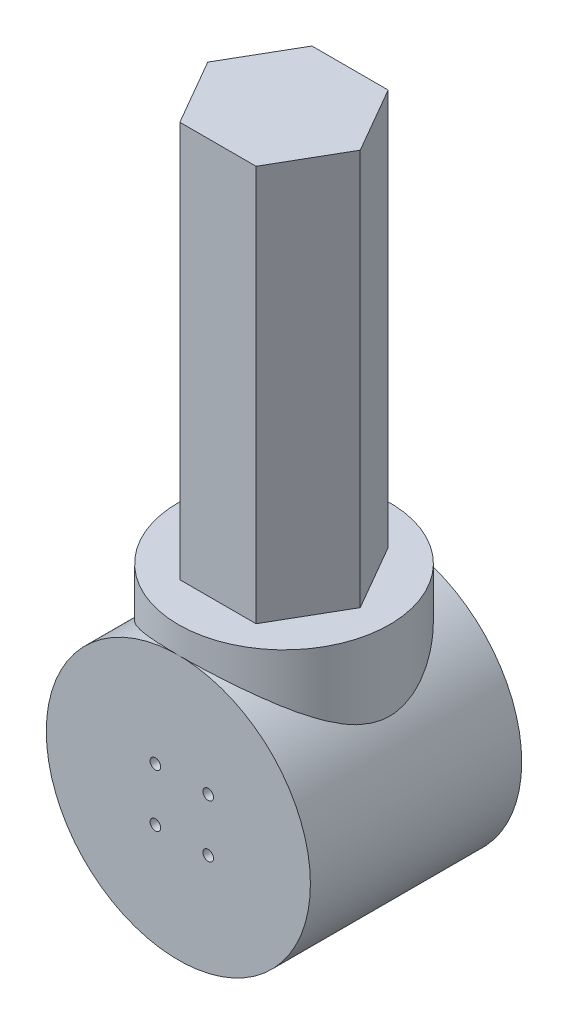
from build123d import *

# Parameters (mm, degrees)
SKETCH1_R           = 25
BOSS_EXTRUDE1_DEPTH = 40
SKETCH2_R           = 20
BOSS_EXTRUDE2_DEPTH = 25
BOSS_EXTRUDE3_DEPTH = 25
BOSS_EXTRUDE4_DEPTH = 50
SKETCH5_R           = 1
CUT_EXTRUDE1_DEPTH  = 50


with BuildPart() as part:
    # Sketch1 → Boss-Extrude1 (new body)
    with BuildSketch(Plane.XY):
        Circle(SKETCH1_R)
    extrude(amount=BOSS_EXTRUDE1_DEPTH)


with BuildPart() as body_2:
    # Sketch2 → Boss-Extrude2 (new body)
    with BuildSketch(Plane(origin=(0, 5, 0), x_dir=(1, 0, 0), z_dir=(0, 1, 0))):
        with Locations(Location((0, -20, 0), (0, 0, 270))):
            Circle(SKETCH2_R)
    extrude(amount=BOSS_EXTRUDE2_DEPTH)

    # Sketch3 → Boss-Extrude3 (add)
    with BuildSketch(Plane(origin=(0, 30, 0), x_dir=(1, 0, 0), z_dir=(0, 1, 0))):
        Polygon((0, -20), (0, -7.5), (-7.216878365, -7.5), (-14.43375673, -20), (-7.216878365, -32.5), (7.216878365, -32.5), (14.43375673, -20), align=None)
        Polygon((7.216878365, -7.5), (0, -7.5), (0, -20), (14.43375673, -20), align=None)
    extrude(amount=BOSS_EXTRUDE3_DEPTH)

    # Sketch4 → Boss-Extrude4 (add)
    with BuildSketch(Plane(origin=(0, 55, 0), x_dir=(1, 0, 0), z_dir=(0, 1, 0))):
        Polygon((7.216878365, -32.5), (14.43375673, -20), (7.216878365, -7.5), (-7.216878365, -7.5), (-14.43375673, -20), (-7.216878365, -32.5), align=None)
    extrude(amount=BOSS_EXTRUDE4_DEPTH)


with BuildPart() as cut_extrude1_tool:
    # Sketch5 → Cut-Extrude1 (new body)
    with BuildSketch(Plane(origin=(0, 0, 0), x_dir=(-1, 0, 0), z_dir=(0, 0, -1))):
        with Locations((-5.654377193, 5)):
            Circle(SKETCH5_R)
        with Locations((4.345622807, 5)):
            Circle(SKETCH5_R)
        with Locations((4.345622807, -5)):
            Circle(SKETCH5_R)
        with Locations((-5.654377193, -5)):
            Circle(SKETCH5_R)
    extrude(amount=-CUT_EXTRUDE1_DEPTH)


with BuildPart() as part_1:
    add(part.part)

    # Cut-Extrude1: cut by cut_extrude1_tool
    add(cut_extrude1_tool.part, mode=Mode.SUBTRACT)


with BuildPart() as body_2_1:
    add(body_2.part)

    # Cut-Extrude1: cut by cut_extrude1_tool
    add(cut_extrude1_tool.part, mode=Mode.SUBTRACT)


solid = Compound([part_1.part, body_2_1.part])
